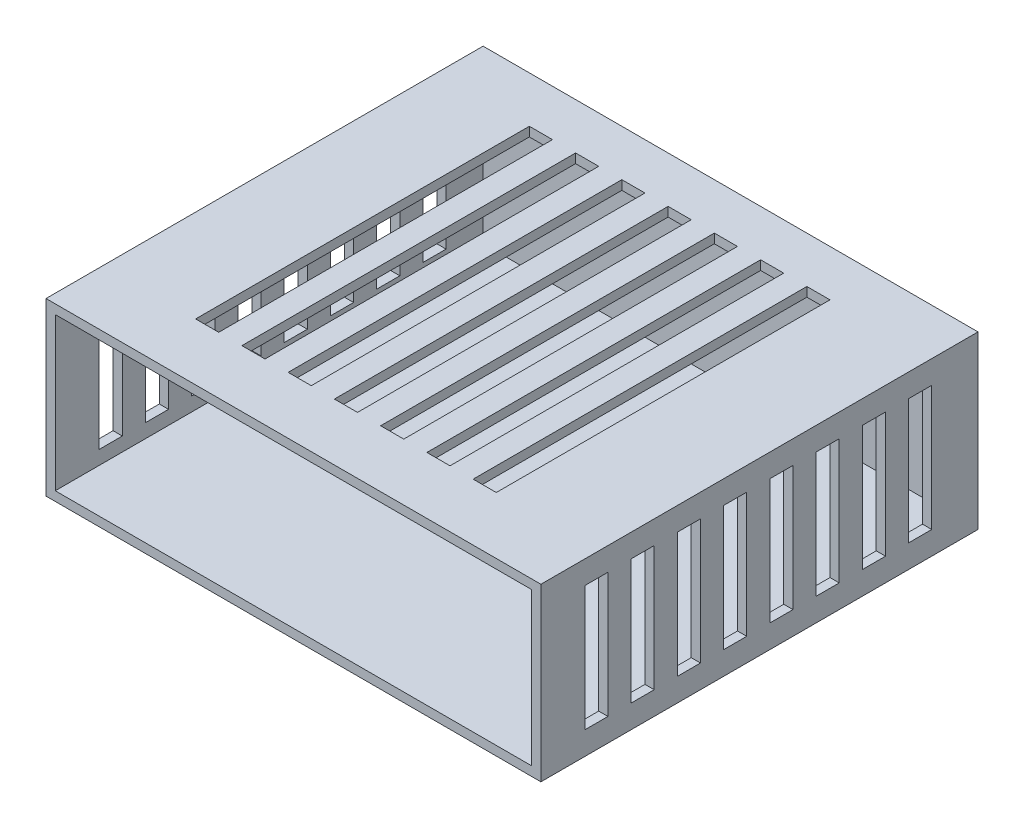
from build123d import *

# Parameters (mm, degrees)
SKETCH_1_W          = 107
SKETCH_1_H          = 94.5
EXTRUDE_1_DEPTH     = 37
SHELL_1_T           = -2
SKETCH_2_W          = 5
SKETCH_2_H          = 72.15042502
CUT_EXTRUDE_3_DEPTH = 20
SKETCH_6_W          = 5
SKETCH_6_H          = 27
CUT_EXTRUDE_4_DEPTH = 1000


with BuildPart() as part:
    # 草图1 → 凸台-拉伸1 (new body)
    with BuildSketch(Plane(origin=(0, 0, 0), x_dir=(1, 0, 0), z_dir=(0, 1, 0))):
        with Locations((53.5, 47.25)):
            Rectangle(SKETCH_1_W, SKETCH_1_H)
    extrude(amount=EXTRUDE_1_DEPTH)

    # 抽壳1
    shell_1_openings = [part.faces().sort_by_distance(p)[0] for p in [
        (53.5, 18.5, 0),
    ]]
    offset(amount=SHELL_1_T, openings=shell_1_openings, kind=Kind.INTERSECTION)

    # 草图2 → 切除-拉伸3 (cut)
    with BuildSketch(Plane(origin=(0, 37, 0), x_dir=(1, 0, 0), z_dir=(0, 1, 0))):
        with Locations((22.5, 48.42478749)):
            Rectangle(SKETCH_2_W, SKETCH_2_H)
        with Locations((32.5, 48.42478749)):
            Rectangle(SKETCH_2_W, SKETCH_2_H)
        with Locations((42.5, 48.42478749)):
            Rectangle(SKETCH_2_W, SKETCH_2_H)
        with Locations((52.5, 48.42478749)):
            Rectangle(SKETCH_2_W, SKETCH_2_H)
        with Locations((62.5, 48.42478749)):
            Rectangle(SKETCH_2_W, SKETCH_2_H)
        with Locations((72.5, 48.42478749)):
            Rectangle(SKETCH_2_W, SKETCH_2_H)
        with Locations((82.5, 48.42478749)):
            Rectangle(SKETCH_2_W, SKETCH_2_H)
    extrude(amount=-CUT_EXTRUDE_3_DEPTH, mode=Mode.SUBTRACT)

    # 草图6 → 切除-拉伸4 (cut)
    with BuildSketch(Plane.ZY):
        with Locations((-82, 18.5)):
            Rectangle(SKETCH_6_W, SKETCH_6_H)
        with Locations((-72, 18.5)):
            Rectangle(SKETCH_6_W, SKETCH_6_H)
        with Locations((-62, 18.5)):
            Rectangle(SKETCH_6_W, SKETCH_6_H)
        with Locations((-52, 18.5)):
            Rectangle(SKETCH_6_W, SKETCH_6_H)
        with Locations((-42, 18.5)):
            Rectangle(SKETCH_6_W, SKETCH_6_H)
        with Locations((-32, 18.5)):
            Rectangle(SKETCH_6_W, SKETCH_6_H)
        with Locations((-22, 18.5)):
            Rectangle(SKETCH_6_W, SKETCH_6_H)
        with Locations((-12, 18.5)):
            Rectangle(SKETCH_6_W, SKETCH_6_H)
    extrude(amount=-CUT_EXTRUDE_4_DEPTH, mode=Mode.SUBTRACT)


solid = part.part
